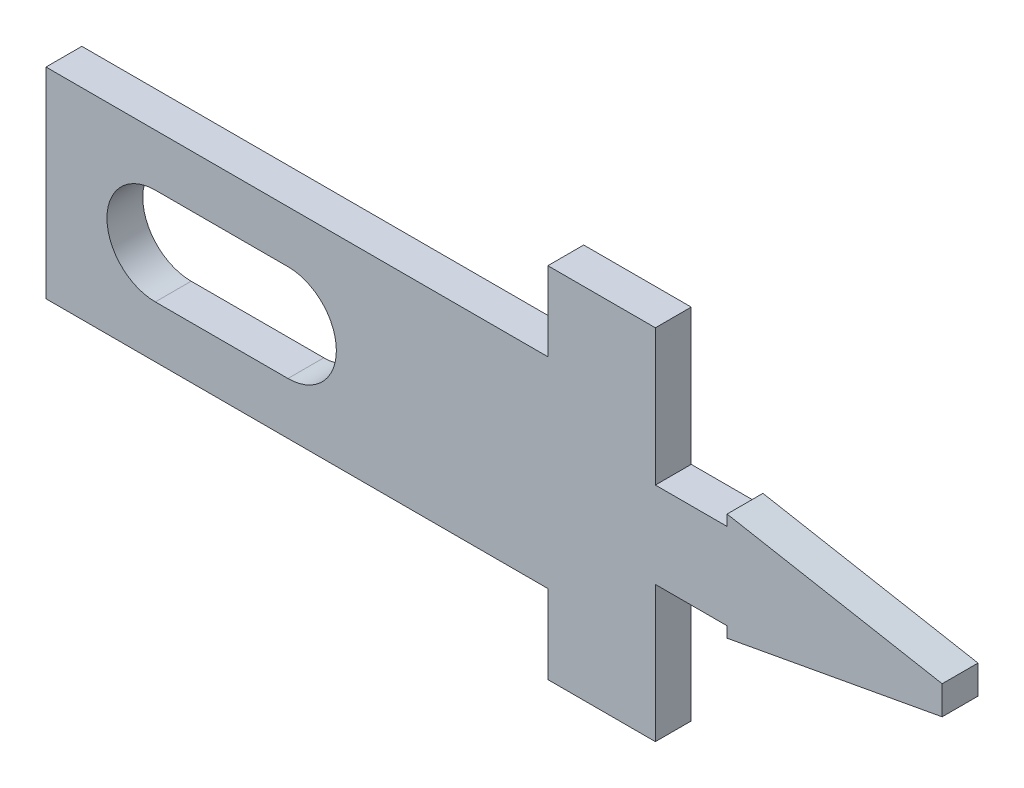
from build123d import *

# Parameters (mm, degrees)
BOSS_EXTRUDE1_DEPTH = 0.5


with BuildPart() as part:
    # Sketch2 → Boss-Extrude1 (new body)
    with BuildSketch(Plane.XY):
        Polygon((-6.25, -1.4), (-6.25, 1.4), (0.75, 1.4), (0.75, 2.5), (2.25, 2.5), (2.25, 0.6), (3.25, 0.6), (3.25, 0.75), (6.25, 0.2), (6.25, -0.2), (3.25, -0.75), (3.25, -0.6), (2.25, -0.6), (2.25, -2.5), (0.75, -2.5), (0.75, -1.4), align=None)
        with BuildLine():
            Line((-2.875, 0.675), (-4.725, 0.675))
            ThreePointArc((-4.725, 0.675), (-5.4, 0), (-4.725, -0.675))
            Line((-4.725, -0.675), (-2.875, -0.675))
            ThreePointArc((-2.875, -0.675), (-2.2, 0), (-2.875, 0.675))
        make_face(mode=Mode.SUBTRACT)
    extrude(amount=BOSS_EXTRUDE1_DEPTH)


solid = part.part
